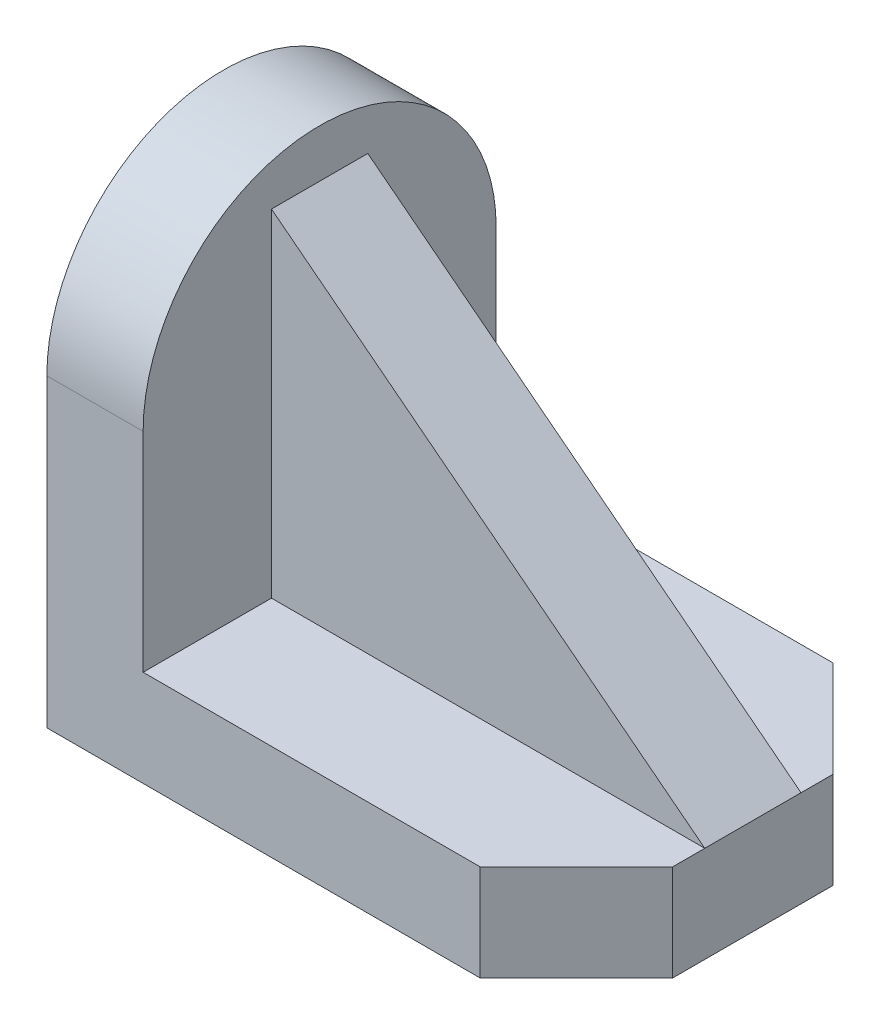
from build123d import *

# Parameters (mm, degrees)
SKETCH1_W           = 66
SKETCH1_H           = 44
BOSS_EXTRUDE1_DEPTH = 12
CHAMFER1_SIZE       = 12
SKETCH2_W           = 44
SKETCH2_H           = 48
BOSS_EXTRUDE2_DEPTH = 12
FILLET1_RADIUS      = 22
FILLET1_LENGTH      = 12
BOSS_EXTRUDE3_DEPTH = 6


with BuildPart() as part:
    # Sketch1 → Boss-Extrude1 (new body)
    with BuildSketch(Plane(origin=(0, 0, 0), x_dir=(1, 0, 0), z_dir=(0, 1, 0))):
        Rectangle(SKETCH1_W, SKETCH1_H)
    extrude(amount=BOSS_EXTRUDE1_DEPTH)

    # Chamfer1
    chamfer1_edges = [part.edges().sort_by_distance(p)[0] for p in [
        (33, 6, 22),
        (33, 6, -22),
    ]]
    chamfer(chamfer1_edges, length=CHAMFER1_SIZE)

    # Sketch2 → Boss-Extrude2 (add)
    with BuildSketch(Plane.ZY.offset(33)):
        with Locations((0, 36)):
            Rectangle(SKETCH2_W, SKETCH2_H)
    extrude(amount=-BOSS_EXTRUDE2_DEPTH)

    # Fillet1: full round fillet: the end face becomes a half cylinder, R = half its width
    fillet1_face = Plane((-27, 60, 0), x_dir=(-1, 0, 0), z_dir=(0, 1, 0))  # on the end face: x along it, z out of the body
    fillet1_slab = fillet1_face.offset(-FILLET1_RADIUS / 2) * Box(FILLET1_LENGTH, 2 * FILLET1_RADIUS, FILLET1_RADIUS, mode=Mode.PRIVATE)  # the body's end, R deep
    fillet1_round = Plane((-27, 38, 0), x_dir=(0, 1, 0), z_dir=(-1, 0, 0)) * Cylinder(FILLET1_RADIUS, FILLET1_LENGTH, mode=Mode.PRIVATE)  # its axis R under the face
    add(fillet1_slab - fillet1_round, mode=Mode.SUBTRACT)

    # Sketch4 → Boss-Extrude3 (add, symmetric)
    with BuildSketch(Plane.XY):
        Polygon((-21, 54), (33, 12), (-21, 12), align=None)
    extrude(amount=BOSS_EXTRUDE3_DEPTH, both=True)


solid = part.part
